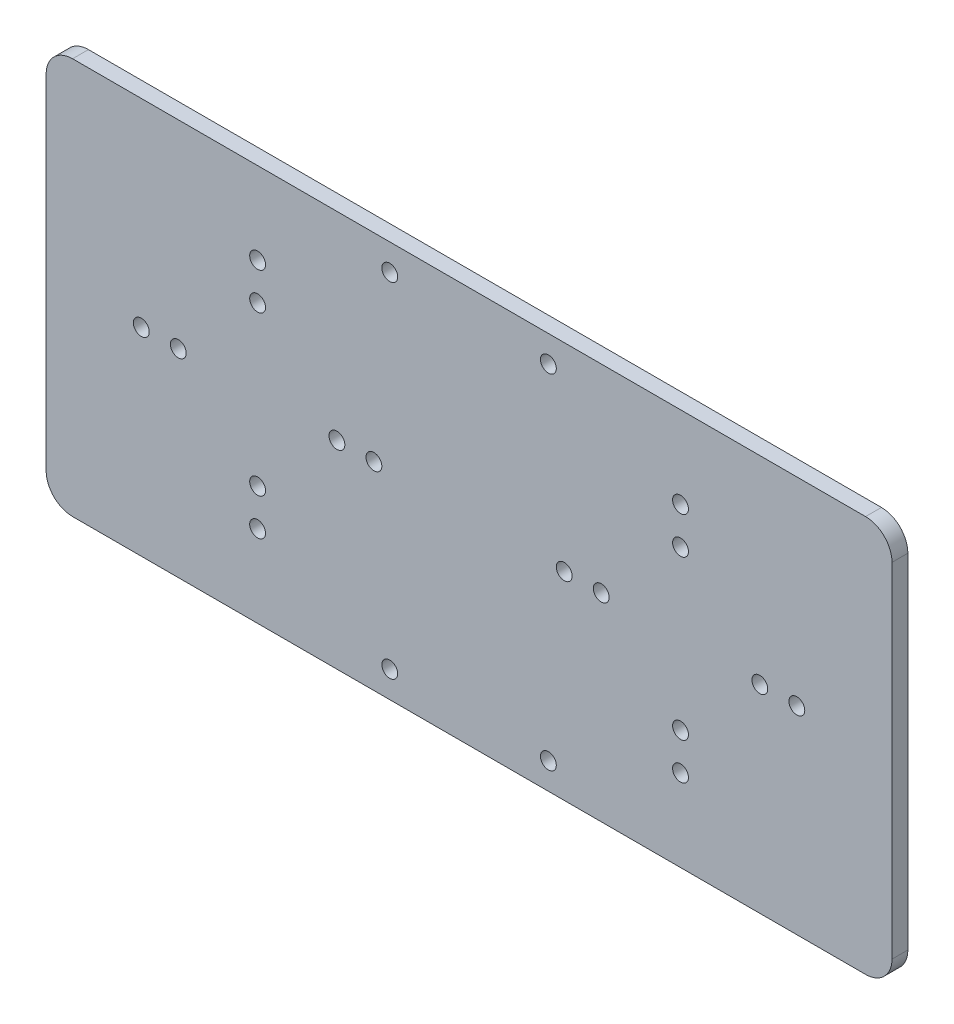
from build123d import *

# Parameters (mm, degrees)
SKETCH_1_W          = 160
SKETCH_1_H          = 75
EXTRUDE_1_DEPTH     = 3
SKETCH_4_R          = 1.5
CUT_EXTRUDE_1_DEPTH = 3
SKETCH_5_R          = 1.5
CUT_EXTRUDE_2_DEPTH = 3
SKETCH_6_R          = 1.5
CUT_EXTRUDE_3_DEPTH = 3
FILLET_1_R          = 5
FILLET_2_R          = 5
FILLET_3_R          = 5
FILLET_4_R          = 5


with BuildPart() as part:
    # 草图1 → 凸台-拉伸1 (new body)
    with BuildSketch(Plane.XY):
        with Locations((80, -37.5)):
            Rectangle(SKETCH_1_W, SKETCH_1_H)
    extrude(amount=EXTRUDE_1_DEPTH)

    # 草图4 → 切除-拉伸1 (cut)
    with BuildSketch(Plane.XY.offset(3)):
        with Locations((40, -15.5)):
            Circle(SKETCH_4_R)
        with Locations((18, -37.5)):
            Circle(SKETCH_4_R)
        with Locations((62, -37.5)):
            Circle(SKETCH_4_R)
        with Locations((40, -59.5)):
            Circle(SKETCH_4_R)
        with Locations((40, -22.5)):
            Circle(SKETCH_4_R)
        with Locations((25, -37.5)):
            Circle(SKETCH_4_R)
        with Locations((55, -37.5)):
            Circle(SKETCH_4_R)
        with Locations((40, -52.5)):
            Circle(SKETCH_4_R)
    extrude(amount=-CUT_EXTRUDE_1_DEPTH, mode=Mode.SUBTRACT)

    # 草图5 → 切除-拉伸2 (cut)
    with BuildSketch(Plane.XY.offset(3)):
        with Locations((120, -15.5)):
            Circle(SKETCH_5_R)
        with Locations((98, -37.5)):
            Circle(SKETCH_5_R)
        with Locations((120, -59.5)):
            Circle(SKETCH_5_R)
        with Locations((142, -37.5)):
            Circle(SKETCH_5_R)
        with Locations((120, -22.5)):
            Circle(SKETCH_5_R)
        with Locations((105, -37.5)):
            Circle(SKETCH_5_R)
        with Locations((120, -52.5)):
            Circle(SKETCH_5_R)
        with Locations((135, -37.5)):
            Circle(SKETCH_5_R)
    extrude(amount=-CUT_EXTRUDE_2_DEPTH, mode=Mode.SUBTRACT)

    # 草图6 → 切除-拉伸3 (cut)
    with BuildSketch(Plane.XY.offset(3)):
        with Locations((65, -5)):
            Circle(SKETCH_6_R)
        with Locations((95, -5)):
            Circle(SKETCH_6_R)
        with Locations((65, -70)):
            Circle(SKETCH_6_R)
        with Locations((95, -70)):
            Circle(SKETCH_6_R)
    extrude(amount=-CUT_EXTRUDE_3_DEPTH, mode=Mode.SUBTRACT)

    # 圆角1
    fillet_1_edges = [part.edges().sort_by_distance(p)[0] for p in [
        (160, 0, 1.5),
    ]]
    fillet(fillet_1_edges, radius=FILLET_1_R)

    # 圆角2
    fillet_2_edges = [part.edges().sort_by_distance(p)[0] for p in [
        (0, 0, 1.5),
    ]]
    fillet(fillet_2_edges, radius=FILLET_2_R)

    # 圆角3
    fillet_3_edges = [part.edges().sort_by_distance(p)[0] for p in [
        (0, -75, 1.5),
    ]]
    fillet(fillet_3_edges, radius=FILLET_3_R)

    # 圆角4
    fillet_4_edges = [part.edges().sort_by_distance(p)[0] for p in [
        (160, -75, 1.5),
    ]]
    fillet(fillet_4_edges, radius=FILLET_4_R)


solid = part.part
